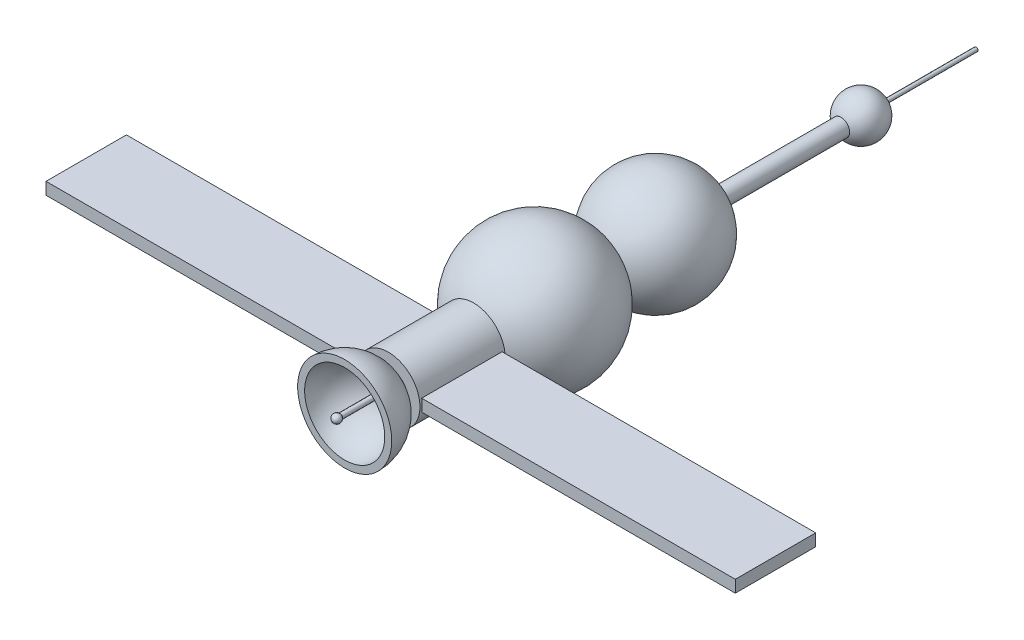
from build123d import *

# Parameters (mm, degrees)
BOSS_EXTRUDE1_DEPTH      = 76.2
BOSS_EXTRUDE1_DEPTH_BACK = 76.2
SKETCH5_W                = 17.78
SKETCH5_H                = 2.673046564


with BuildPart() as part:
    # Sketch2 → Revolve3 (revolve)
    with BuildSketch(Plane(origin=(0, 0, 0), x_dir=(1, 0, 0), z_dir=(0, 1, 0))):
        with BuildLine():
            ThreePointArc((-3.876390583, -32.397183493), (-8.617049849, -36.223897247), (-10.401322414, -42.049183493))
            Line((-10.401322414, -42.049183493), (-8.857960585, -42.049183493))
            ThreePointArc((-8.857960585, -42.049183493), (-6.462421767, -35.991083905), (-0.5715, -33.20967822))
            Line((-0.5715, -33.20967822), (-0.5715, -43.074960129))
            ThreePointArc((-0.5715, -43.074960129), (-0.879090428, -44.110253802), (0, -44.737665056))
            Line((0, -44.737665056), (0, 34.662689732))
            Line((0, 34.662689732), (-1.905, 34.662689732))
            Line((-1.905, 34.662689732), (-1.905, 39.226312158))
            ThreePointArc((-1.905, 39.226312158), (-12.647506894, 27.823503079), (-4.145046213, 14.66547619))
            ThreePointArc((-4.145046213, 14.66547619), (-15.16335735, 1.526497253), (-6.985, -13.54501292))
            Line((-6.985, -13.54501292), (-6.985, -32.397183493))
            Line((-6.985, -32.397183493), (-3.876390583, -32.397183493))
        make_face()
        with BuildLine():
            Line((-1.905, 67.682689732), (-1.905, 39.226312158))
            ThreePointArc((-1.905, 39.226312158), (-0.955205632, 39.334027093), (0, 39.37))
            Line((0, 39.37), (0, 67.290818504))
            ThreePointArc((0, 67.290818504), (-0.972443836, 67.389801329), (-1.905, 67.682689732))
        make_face()
        with BuildLine():
            ThreePointArc((-0.432225774, 76.924055539), (-4.766168962, 72.876706488), (-1.905, 67.682689732))
            Line((-1.905, 67.682689732), (0, 67.682689732))
            Line((0, 67.682689732), (0, 74.03474257))
            Line((0, 74.03474257), (-0.432225774, 74.03474257))
            Line((-0.432225774, 74.03474257), (-0.432225774, 76.924055539))
        make_face()
        with BuildLine():
            Line((-0.432225774, 97.540660197), (-0.432225774, 76.924055539))
            ThreePointArc((-0.432225774, 76.924055539), (-0.216330312, 76.938597987), (0, 76.943448721))
            Line((0, 76.943448721), (0, 97.540660197))
            Line((0, 97.540660197), (-0.432225774, 97.540660197))
        make_face()
    revolve(axis=Axis((0, 0, -98.635274561), (0, 0, 1)))

    # Sketch5 → Boss-Extrude1 (add, two sides: drawn at the far end of the back side and taken through both)
    with BuildSketch(Plane(origin=(0, 0, 0), x_dir=(0, 0, -1), z_dir=(1, 0, 0)).offset(-BOSS_EXTRUDE1_DEPTH_BACK)):
        with Locations((-22.999183493, 0)):
            Rectangle(SKETCH5_W, SKETCH5_H)
    extrude(amount=BOSS_EXTRUDE1_DEPTH + BOSS_EXTRUDE1_DEPTH_BACK)


solid = part.part
